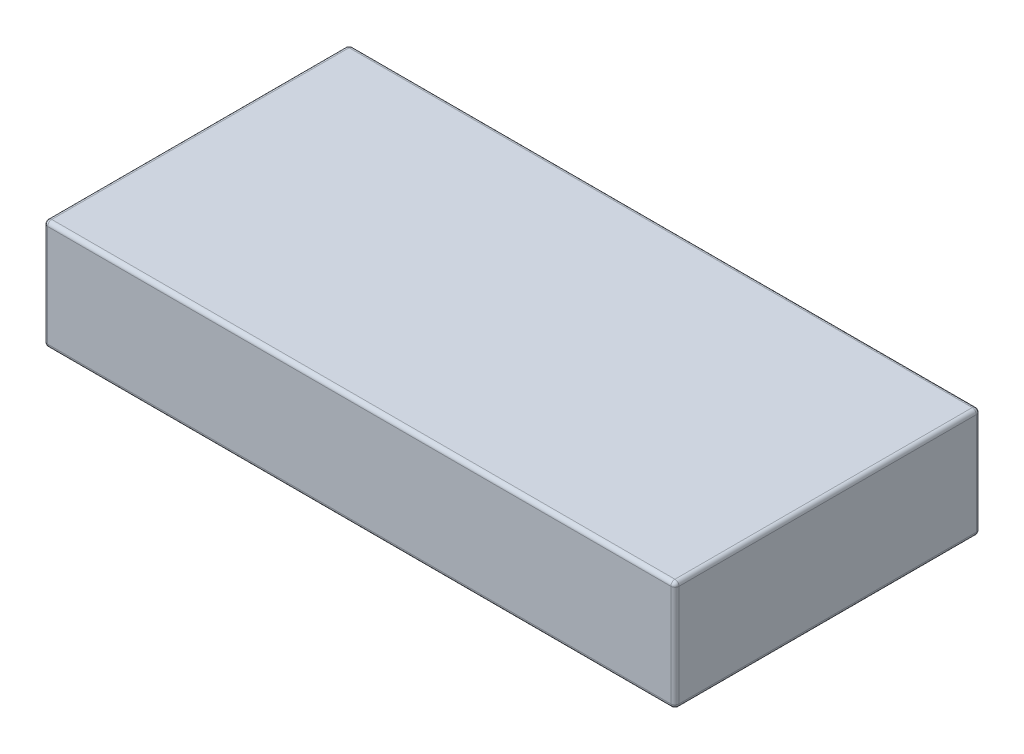
from build123d import *

# Parameters (mm, degrees)
SKETCH1_W           = 155
SKETCH1_H           = 75
BOSS_EXTRUDE1_DEPTH = 27
FILLET1_R           = 1


with BuildPart() as part:
    # Sketch1 → Boss-Extrude1 (new body)
    with BuildSketch(Plane(origin=(0, 0, 0), x_dir=(1, 0, 0), z_dir=(0, 1, 0))):
        Rectangle(SKETCH1_W, SKETCH1_H)
    extrude(amount=BOSS_EXTRUDE1_DEPTH)

    # Fillet1
    fillet1_edges = [part.edges().sort_by_distance(p)[0] for p in [
        (-77.5, 27, 0),
        (0, 27, 37.5),
        (77.5, 27, 0),
        (0, 0, 37.5),
        (-77.5, 0, 0),
        (0, 0, -37.5),
        (77.5, 0, 0),
        (77.5, 13.5, 37.5),
        (-77.5, 13.5, 37.5),
        (-77.5, 13.5, -37.5),
        (77.5, 13.5, -37.5),
        (0, 27, -37.5),
    ]]
    fillet(fillet1_edges, radius=FILLET1_R)


solid = part.part
